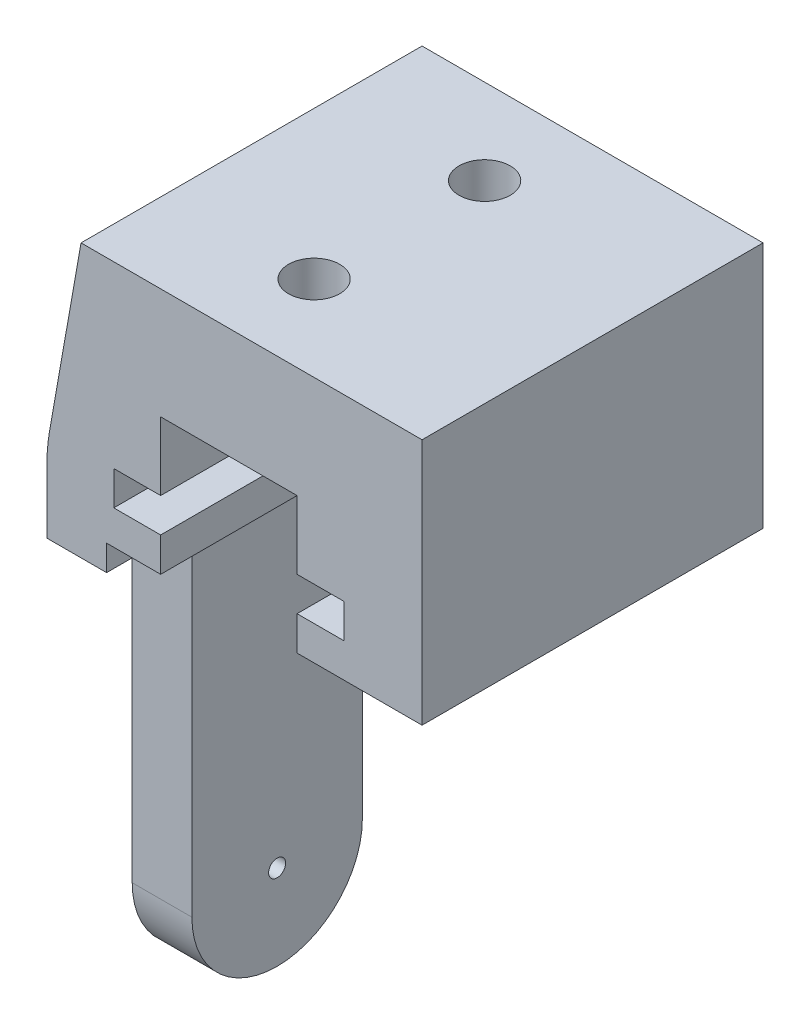
from build123d import *

# Parameters (mm, degrees)
SKETCH1_W           = 22
SKETCH1_H           = 16
BOSS_EXTRUDE1_DEPTH = 20
CHAMFER1_SIZE       = 2
CHAMFER1_SIZE2      = 11.342563639
CUT_EXTRUDE1_DEPTH  = 20
FILLET1_R           = 10
SKETCH3_W           = 3.5
SKETCH3_H           = 10
BOSS_EXTRUDE2_DEPTH = 20
FILLET2_R           = 1
BOSS_EXTRUDE3_DEPTH = 3.5
SKETCH8_R           = 0.5
CUT_EXTRUDE2_DEPTH  = 3.5
SKETCH9_R           = 1.5
CUT_EXTRUDE3_DEPTH  = 6.5


with BuildPart() as part:
    # Sketch1 → Boss-Extrude1 (new body)
    with BuildSketch(Plane.XY):
        with Locations((11, -8)):
            Rectangle(SKETCH1_W, SKETCH1_H)
    extrude(amount=BOSS_EXTRUDE1_DEPTH)

    # Chamfer1
    chamfer1_edges = [part.edges().sort_by_distance(p)[0] for p in [
        (0, 0, 10),
    ]]
    chamfer1_side = [part.faces().sort_by_distance(p)[0] for p in [
        (11, 0, 10),
    ]]
    chamfer(chamfer1_edges, length=CHAMFER1_SIZE, length2=CHAMFER1_SIZE2, reference=chamfer1_side[0])

    # Sketch2 → Cut-Extrude1 (cut)
    with BuildSketch(Plane.XY.offset(20)):
        Polygon((3.5, -16), (3.5, -14.5), (6.67, -14.5), (6.67, -12.5), (3.92, -12.5), (3.92, -10.5), (6.67, -10.5), (6.67, -6.5), (14.67, -6.5), (14.67, -10.5), (17.42, -10.5), (17.42, -12.5), (14.67, -12.5), (14.67, -14.5), (22, -14.5), (22, -16), align=None)
    extrude(amount=-CUT_EXTRUDE1_DEPTH, mode=Mode.SUBTRACT)

    # Fillet1
    fillet1_edges = [part.edges().sort_by_distance(p)[0] for p in [
        (0, -11.342563639, 10),
    ]]
    fillet(fillet1_edges, radius=FILLET1_R)

    # Sketch3 → Boss-Extrude2 (add)
    with BuildSketch(Plane.XZ.offset(16)):
        with Locations((1.75, 10)):
            Rectangle(SKETCH3_W, SKETCH3_H)
    extrude(amount=BOSS_EXTRUDE2_DEPTH)

    # Fillet2
    fillet2_edges = [part.edges().sort_by_distance(p)[0] for p in [
        (1.75, -16, 5),
        (1.75, -16, 15),
    ]]
    fillet(fillet2_edges, radius=FILLET2_R)

    # Sketch7 → Boss-Extrude3 (add)
    with BuildSketch(Plane.ZY):
        with BuildLine():
            Line((15, -36), (5, -36))
            ThreePointArc((5, -36), (10, -41), (15, -36))
        make_face()
    extrude(amount=-BOSS_EXTRUDE3_DEPTH)

    # Sketch8 → Cut-Extrude2 (cut)
    with BuildSketch(Plane.ZY):
        with Locations(Location((10, -36, 0), (0, 0, 270))):
            Circle(SKETCH8_R)
    extrude(amount=-CUT_EXTRUDE2_DEPTH, mode=Mode.SUBTRACT)

    # Sketch9 → Cut-Extrude3 (cut)
    with BuildSketch(Plane.XZ.offset(6.5)):
        with Locations(Location((10.67, 15, 0), (0, 0, 270))):
            Circle(SKETCH9_R)
        with Locations(Location((10.67, 5, 0), (0, 0, 270))):
            Circle(SKETCH9_R)
    extrude(amount=-CUT_EXTRUDE3_DEPTH, mode=Mode.SUBTRACT)


solid = part.part
